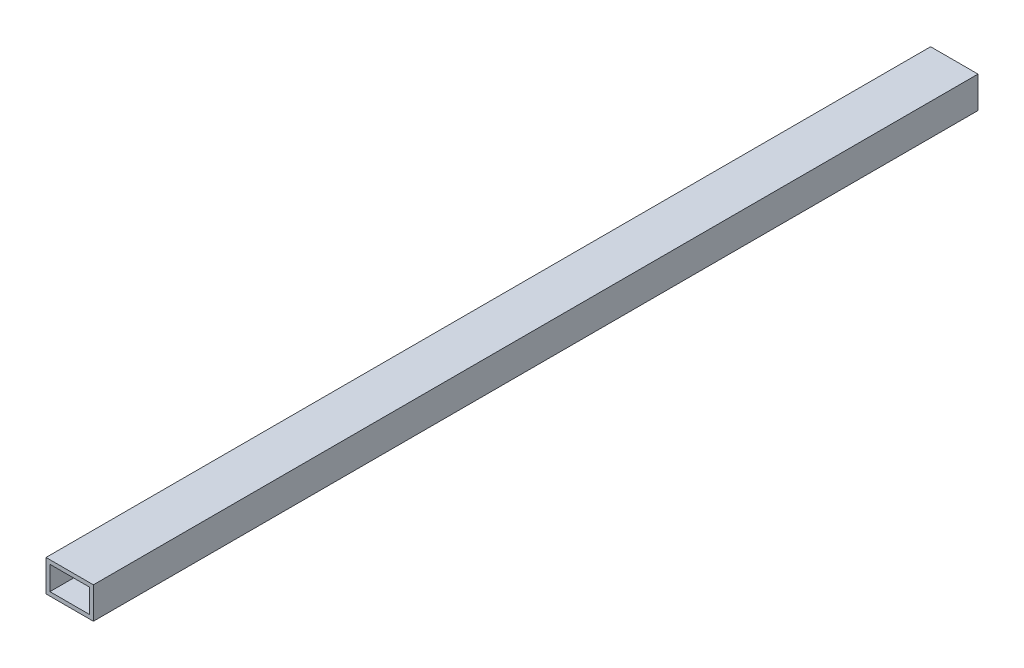
from build123d import *

# Parameters (mm, degrees)
SKETCH1_W           = 38.1
SKETCH1_H           = 25.4
BOSS_EXTRUDE1_DEPTH = 711.2
SHELL1_T            = -3.175


with BuildPart() as part:
    # Sketch1 → Boss-Extrude1 (new body)
    with BuildSketch(Plane.XY):
        Rectangle(SKETCH1_W, SKETCH1_H)
    extrude(amount=BOSS_EXTRUDE1_DEPTH)

    # Shell1
    shell1_openings = [part.faces().sort_by_distance(p)[0] for p in [
        (0, 0, 711.2),
        (0, 0, 0),
    ]]
    offset(amount=SHELL1_T, openings=shell1_openings, kind=Kind.INTERSECTION)


solid = part.part
